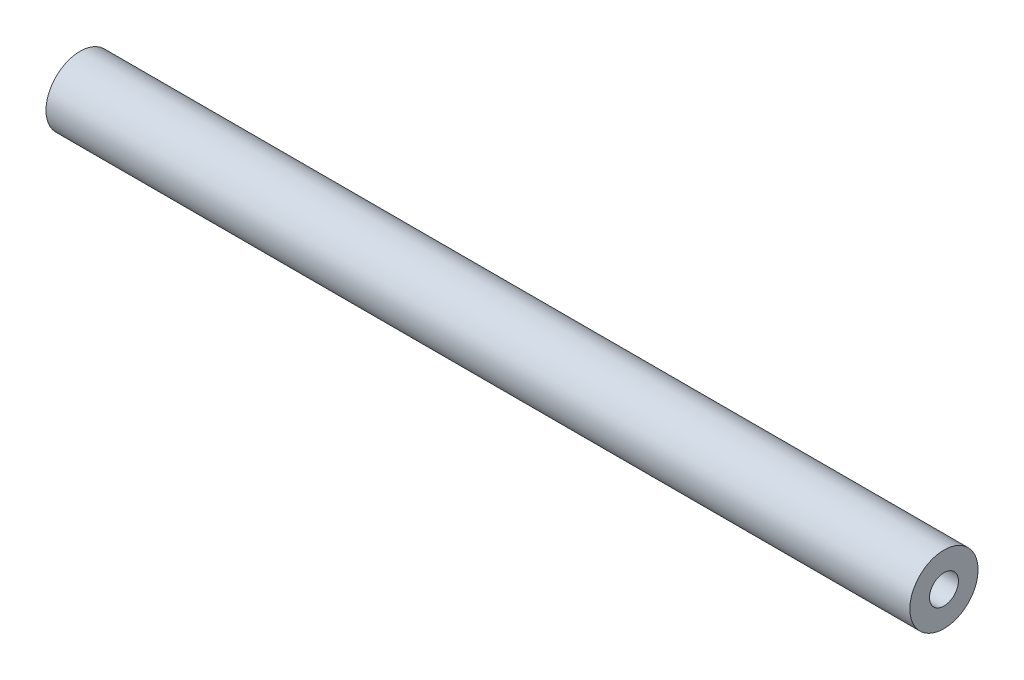
from build123d import *

# Parameters (mm, degrees)
SKETCH1_R                            = 4.7625
BOSS_EXTRUDE1_DEPTH                  = 60.325
F_10_32_TAPPED_HOLE1_D               = 4.0386
F_10_32_TAPPED_HOLE1_DEPTH           = 16.256
F_10_32_TAPPED_HOLE1_TIP             = 1.213317848
F_10_32_TAPPED_HOLE1_ON_FACE_2_D     = 4.0386
F_10_32_TAPPED_HOLE1_ON_FACE_2_DEPTH = 16.256
F_10_32_TAPPED_HOLE1_ON_FACE_2_TIP   = 1.213317848


with BuildPart() as part:
    # Sketch1 → Boss-Extrude1 (new, symmetric)
    with BuildSketch(Plane(origin=(0, 0, 0), x_dir=(0, 0, -1), z_dir=(1, 0, 0))):
        with Locations(Location((0, 0, 0), (0, 0, 180))):
            Circle(SKETCH1_R)
    extrude(amount=BOSS_EXTRUDE1_DEPTH, both=True)

    # #10-32 Tapped Hole1
    with Locations(Plane(origin=(60.325, 0, 0), x_dir=(0, 0, 1), z_dir=(1, 0, 0))):
        with Locations((0, 0)):
            Hole(F_10_32_TAPPED_HOLE1_D / 2, depth=F_10_32_TAPPED_HOLE1_DEPTH)
            with Locations((0, 0, -(F_10_32_TAPPED_HOLE1_DEPTH + F_10_32_TAPPED_HOLE1_TIP / 2))):  # 118° drill point
                Cone(0, F_10_32_TAPPED_HOLE1_D / 2, F_10_32_TAPPED_HOLE1_TIP, mode=Mode.SUBTRACT)

    # #10-32 Tapped Hole1 on face 2
    with Locations(Plane(origin=(-60.325, 0, 0), x_dir=(0, 0, -1), z_dir=(-1, 0, 0))):
        with Locations((0, 0)):
            Hole(F_10_32_TAPPED_HOLE1_ON_FACE_2_D / 2, depth=F_10_32_TAPPED_HOLE1_ON_FACE_2_DEPTH)
            with Locations((0, 0, -(F_10_32_TAPPED_HOLE1_ON_FACE_2_DEPTH + F_10_32_TAPPED_HOLE1_ON_FACE_2_TIP / 2))):  # 118° drill point
                Cone(0, F_10_32_TAPPED_HOLE1_ON_FACE_2_D / 2, F_10_32_TAPPED_HOLE1_ON_FACE_2_TIP, mode=Mode.SUBTRACT)


solid = part.part
